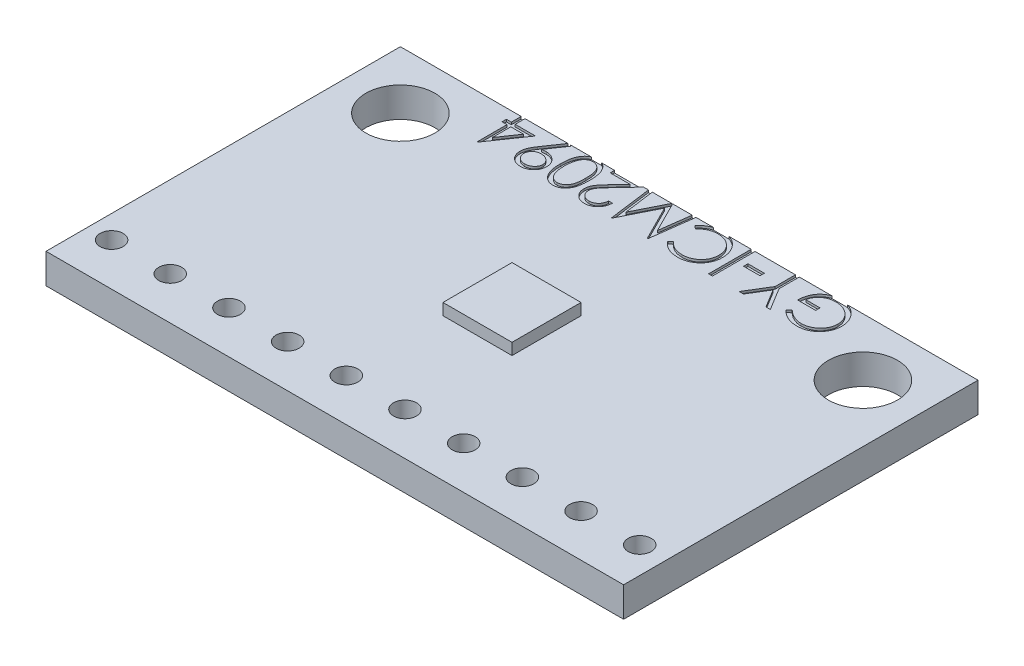
from build123d import *

# Parameters (mm, degrees)
SKETCH2_W           = 25.1
SKETCH2_H           = 15.4
SKETCH2_R           = 1.5
SKETCH2_R_2         = 0.5
BOSS_EXTRUDE1_DEPTH = 1.3
SKETCH3_W           = 3
SKETCH3_H           = 3
BOSS_EXTRUDE2_DEPTH = 0.5
SKETCH4_W           = 0.712339744
SKETCH4_H           = 0.189957265
SKETCH4_W_2         = 0.166212606
SKETCH4_H_2         = 1.852083333
CUT_EXTRUDE1_DEPTH  = 0.1


with BuildPart() as part:
    # Sketch2 → Boss-Extrude1 (new body)
    with BuildSketch(Plane(origin=(0, 0, 0), x_dir=(1, 0, 0), z_dir=(0, 1, 0))):
        Rectangle(SKETCH2_W, SKETCH2_H)
        with Locations(Location((-10.05, 5.2, 0), (0, 0, 270))):
            Circle(SKETCH2_R, mode=Mode.SUBTRACT)
        with Locations(Location((10.05, 5.2, 0), (0, 0, 270))):
            Circle(SKETCH2_R, mode=Mode.SUBTRACT)
        with Locations(Location((-11.55, -5.850560691, 0), (0, 0, 270))):
            Circle(SKETCH2_R_2, mode=Mode.SUBTRACT)
        with Locations(Location((-9, -5.850560691, 0), (0, 0, 270))):
            Circle(SKETCH2_R_2, mode=Mode.SUBTRACT)
        with Locations(Location((-6.45, -5.850560691, 0), (0, 0, 270))):
            Circle(SKETCH2_R_2, mode=Mode.SUBTRACT)
        with Locations(Location((-3.9, -5.850560691, 0), (0, 0, 270))):
            Circle(SKETCH2_R_2, mode=Mode.SUBTRACT)
        with Locations(Location((-1.35, -5.850560691, 0), (0, 0, 270))):
            Circle(SKETCH2_R_2, mode=Mode.SUBTRACT)
        with Locations(Location((1.2, -5.850560691, 0), (0, 0, 270))):
            Circle(SKETCH2_R_2, mode=Mode.SUBTRACT)
        with Locations(Location((3.75, -5.850560691, 0), (0, 0, 270))):
            Circle(SKETCH2_R_2, mode=Mode.SUBTRACT)
        with Locations(Location((6.3, -5.850560691, 0), (0, 0, 270))):
            Circle(SKETCH2_R_2, mode=Mode.SUBTRACT)
        with Locations(Location((8.85, -5.850560691, 0), (0, 0, 270))):
            Circle(SKETCH2_R_2, mode=Mode.SUBTRACT)
        with Locations(Location((11.4, -5.850560691, 0), (0, 0, 270))):
            Circle(SKETCH2_R_2, mode=Mode.SUBTRACT)
    extrude(amount=BOSS_EXTRUDE1_DEPTH)

    # Sketch3 → Boss-Extrude2 (add)
    with BuildSketch(Plane(origin=(0, 1.3, 0), x_dir=(1, 0, 0), z_dir=(0, 1, 0))):
        Rectangle(SKETCH3_W, SKETCH3_H)
    extrude(amount=BOSS_EXTRUDE2_DEPTH)

    # Sketch4 → Cut-Extrude1 (cut)
    # profile 1 of 10: a face of its own
    with BuildSketch(Plane(origin=(0, 1.3, 0), x_dir=(1, 0, 0), z_dir=(0, 1, 0))):
        with BuildLine():
            Line((5.734334936, 6.164017428), (5.876802885, 6.299065171))
            add(Edge.make_bspline(
                [(5.876802885, 6.299065171), (5.902734255, 6.274846309), (5.953840983, 6.227114669), (6.036763977, 6.164492909), (6.123400923, 6.111266201), (6.213047457, 6.067536404), (6.303974858, 6.033543694), (6.394367757, 6.008965172), (6.483592414, 5.993158181), (6.542827681, 5.991301423), (6.572076155, 5.990384615)],
                knots=[0, 0, 0, 0, 1.091957225, 2.152079168, 3.193085318, 4.218301889, 5.218403563, 6.17723952, 7.099979378, 8, 8, 8, 8], degree=3))
            add(Edge.make_bspline(
                [(6.572076155, 5.990384615), (6.590022583, 5.990603805), (6.625868894, 5.991041616), (6.679116172, 5.996616453), (6.73179789, 6.004659252), (6.783732376, 6.016176617), (6.835126115, 6.031135726), (6.885864777, 6.049196619), (6.935850436, 6.070938083), (6.984820129, 6.095725341), (7.03253663, 6.122784711), (7.077414253, 6.152963922), (7.119640144, 6.185334269), (7.1589157, 6.220320282), (7.195778908, 6.25733966), (7.229554971, 6.296918405), (7.26098252, 6.338470714), (7.288886059, 6.38259221), (7.31410674, 6.428029253), (7.335945702, 6.474419652), (7.354750313, 6.521436225), (7.369776345, 6.569105475), (7.381856699, 6.617396963), (7.390407331, 6.666235238), (7.395209989, 6.715860927), (7.396042493, 6.749090919), (7.396461004, 6.765796107)],
                knots=[0, 0, 0, 0, 1.028307134, 2.053947307, 3.065600992, 4.082111276, 5.100671203, 6.132125737, 7.167228006, 8.222953114, 9.277225349, 10.309459149, 11.320441984, 12.324791754, 13.322338422, 14.312705492, 15.305176196, 16.306142747, 17.302479595, 18.282363326, 19.243345101, 20.20291386, 21.145121196, 22.094978082, 23.042318507, 24, 24, 24, 24], degree=3))
            add(Edge.make_bspline(
                [(7.396461004, 6.765796107), (7.39605728, 6.782871708), (7.395250933, 6.816976281), (7.390196113, 6.867894511), (7.380498624, 6.917952712), (7.368653259, 6.967623129), (7.351886468, 7.016271786), (7.332395595, 7.064611124), (7.308893972, 7.112191889), (7.281831328, 7.15868242), (7.251924201, 7.203924919), (7.219036989, 7.246900209), (7.183107579, 7.28710605), (7.144796551, 7.325130268), (7.103754365, 7.360732741), (7.059582961, 7.393484377), (7.01290062, 7.423891606), (6.963686645, 7.451620381), (6.912461205, 7.47638928), (6.859938011, 7.498415424), (6.805948246, 7.516554863), (6.750775918, 7.531338788), (6.694486725, 7.543456859), (6.636794964, 7.551252797), (6.578124822, 7.556910028), (6.538575629, 7.557323662), (6.518650674, 7.557532051)],
                knots=[0, 0, 0, 0, 0.935896426, 1.86923723, 2.799743935, 3.728471844, 4.66505513, 5.616527375, 6.583419551, 7.570341864, 8.562833498, 9.553750335, 10.533080376, 11.5155245, 12.510142773, 13.507781369, 14.526649666, 15.561487327, 16.601173999, 17.643331812, 18.680652164, 19.71969803, 20.772446191, 21.833473655, 22.9085001, 24, 24, 24, 24], degree=3))
            add(Edge.make_bspline(
                [(6.518650674, 7.557532051), (6.494637868, 7.557030305), (6.447484821, 7.556045043), (6.37817255, 7.548369019), (6.311596702, 7.536395848), (6.247974039, 7.518806839), (6.187073559, 7.496543543), (6.129120272, 7.4690116), (6.073952678, 7.436501606), (6.02181505, 7.399668473), (5.973926709, 7.358640205), (5.93039891, 7.314725941), (5.892507166, 7.267575287), (5.860004363, 7.217198505), (5.832028809, 7.164337374), (5.809713076, 7.108085865), (5.792452934, 7.049072276), (5.785392019, 7.008274646), (5.781824252, 6.987660256)],
                knots=[0, 0, 0, 0, 1.130234505, 2.219399076, 3.279128566, 4.311639422, 5.322903917, 6.328167287, 7.327698761, 8.334124803, 9.329374007, 10.292761544, 11.24113083, 12.171311216, 13.111441694, 14.052040787, 15.015727358, 16, 16, 16, 16], degree=3))
            Line((5.781824252, 6.987660256), (6.399185363, 6.987660256))
            Line((6.399185363, 6.987660256), (6.399185363, 6.797702991))
            Line((6.399185363, 6.797702991), (5.615611645, 6.797702991))
            add(Edge.make_bspline(
                [(5.615611645, 6.797702991), (5.616514323, 6.833108204), (5.618281028, 6.902402601), (5.630673537, 7.003457703), (5.650684775, 7.098904391), (5.67802169, 7.188843183), (5.713409859, 7.273146626), (5.756469489, 7.351900313), (5.807889736, 7.424595473), (5.865839011, 7.491825571), (5.930873572, 7.551795613), (6.001236134, 7.604503755), (6.077042946, 7.648902222), (6.158222303, 7.685023489), (6.244508449, 7.713214312), (6.33610105, 7.733201771), (6.432875897, 7.745176793), (6.499199888, 7.746706815), (6.533120075, 7.747489316)],
                knots=[0, 0, 0, 0, 1.140356446, 2.231883559, 3.274166699, 4.278491846, 5.25512956, 6.21435461, 7.1637429, 8.11826594, 9.068280886, 10.0076534, 10.945064095, 11.891975133, 12.864533718, 13.863980011, 14.907571808, 16, 16, 16, 16], degree=3))
            add(Edge.make_bspline(
                [(6.533120075, 7.747489316), (6.554027522, 7.747188156), (6.595263745, 7.746594172), (6.656166028, 7.742372825), (6.715389102, 7.735874354), (6.77292434, 7.726060893), (6.82898338, 7.714041055), (6.883286243, 7.698649333), (6.93603979, 7.680832979), (6.987325558, 7.660568185), (7.036678047, 7.637088184), (7.084317079, 7.610995166), (7.130505987, 7.582423679), (7.174930145, 7.550879607), (7.21782102, 7.516598888), (7.25890205, 7.479512815), (7.298403219, 7.439734764), (7.323147298, 7.411488371), (7.335615318, 7.397255609)],
                knots=[0, 0, 0, 0, 1.107784379, 2.184907829, 3.233506516, 4.263428166, 5.276301166, 6.270063455, 7.25232949, 8.225834625, 9.190232166, 10.146266622, 11.1027726, 12.066435141, 13.031522626, 14.010570082, 14.99756817, 16, 16, 16, 16], degree=3))
            add(Edge.make_bspline(
                [(7.335615318, 7.397255609), (7.353705373, 7.374675722), (7.389585209, 7.32989075), (7.4357699, 7.25813578), (7.475140642, 7.183839795), (7.507085281, 7.106795971), (7.532029185, 7.027076371), (7.549918327, 6.944782863), (7.560399685, 6.859809475), (7.561909681, 6.802307439), (7.562673611, 6.773216313)],
                knots=[0, 0, 0, 0, 1.023165419, 2.029347347, 3.013907458, 3.994755782, 4.975994455, 5.96558838, 6.970761222, 8, 8, 8, 8], degree=3))
            add(Edge.make_bspline(
                [(7.562673611, 6.773216313), (7.562391205, 6.751432733), (7.561829983, 6.70814243), (7.555054373, 6.643867902), (7.545274963, 6.580750555), (7.531109863, 6.518731949), (7.512472141, 6.458087418), (7.490088955, 6.398350974), (7.463871877, 6.339761379), (7.433277509, 6.282837929), (7.399975893, 6.227600091), (7.362528752, 6.175786487), (7.323016339, 6.126395257), (7.279545662, 6.080824762), (7.233745666, 6.037619209), (7.184477141, 5.997917362), (7.132548411, 5.96104938), (7.07754017, 5.927736706), (7.020324955, 5.897802722), (6.961025909, 5.871562407), (6.899664911, 5.849875229), (6.836700658, 5.831474151), (6.771656827, 5.817866543), (6.705005352, 5.807998252), (6.636398835, 5.801245767), (6.590024769, 5.800702707), (6.566511001, 5.80042735)],
                knots=[0, 0, 0, 0, 1.009025537, 2.005226976, 2.991671811, 3.967589759, 4.950148279, 5.929425679, 6.922109907, 7.921964004, 8.922507644, 9.908469609, 10.882248289, 11.851158214, 12.824245259, 13.798023939, 14.780666017, 15.773333703, 16.775582742, 17.771174102, 18.775387309, 19.789283316, 20.80873549, 21.851817535, 22.910773411, 24, 24, 24, 24], degree=3))
            add(Edge.make_bspline(
                [(6.566511001, 5.80042735), (6.54733479, 5.800733232), (6.509310617, 5.801339758), (6.452731137, 5.8055656), (6.397137584, 5.812189289), (6.342251081, 5.821451408), (6.288280611, 5.833703689), (6.235062662, 5.848635675), (6.182697886, 5.865924029), (6.131248581, 5.886558601), (6.080364947, 5.909975333), (6.029765105, 5.936335159), (5.979621657, 5.966087496), (5.929847725, 5.99932105), (5.880129416, 6.035464938), (5.831253126, 6.075552925), (5.782039068, 6.118004133), (5.750393941, 6.148527622), (5.734334936, 6.164017428)],
                knots=[0, 0, 0, 0, 0.985875312, 1.954874891, 2.915472732, 3.863573565, 4.815313299, 5.759461513, 6.704487138, 7.649063459, 8.607849844, 9.583336382, 10.581114205, 11.603942397, 12.659508253, 13.739925933, 14.853076422, 16, 16, 16, 16], degree=3))
        make_face()
    # profile 2 of 10: a face of its own
    with BuildSketch(Plane(origin=(0, 1.3, 0), x_dir=(1, 0, 0), z_dir=(0, 1, 0))):
        Polygon((5.378165064, 5.847916667), (5.187836789, 5.847916667), (4.701813318, 6.642991703), (4.215418837, 5.847916667), (4.024719551, 5.847916667), (4.618336004, 6.819592598), (4.618336004, 7.7), (4.784548611, 7.7), (4.784548611, 6.819592598), align=None)
    # profile 3 of 10: a face of its own
    with BuildSketch(Plane(origin=(0, 1.3, 0), x_dir=(1, 0, 0), z_dir=(0, 1, 0))):
        with Locations((3.526081731, 6.987660256)):
            Rectangle(SKETCH4_W, SKETCH4_H)
    # profile 4 of 10: a face of its own
    with BuildSketch(Plane(origin=(0, 1.3, 0), x_dir=(1, 0, 0), z_dir=(0, 1, 0))):
        with Locations((2.778125, 6.773958334)):
            Rectangle(SKETCH4_W_2, SKETCH4_H_2)
    # profile 5 of 10: a face of its own
    with BuildSketch(Plane(origin=(0, 1.3, 0), x_dir=(1, 0, 0), z_dir=(0, 1, 0))):
        with BuildLine():
            Line((0.581744124, 6.187762086), (0.727180155, 6.299065171))
            add(Edge.make_bspline(
                [(0.727180155, 6.299065171), (0.737555044, 6.286700842), (0.758164946, 6.262138883), (0.791320544, 6.227645637), (0.825881844, 6.195340926), (0.861800758, 6.165017188), (0.899908532, 6.137893197), (0.938753154, 6.111856513), (0.97974602, 6.089060501), (1.036143473, 6.06121232), (1.110208633, 6.032786364), (1.203122279, 6.008337588), (1.300248608, 5.992920752), (1.366496472, 5.991239678), (1.400192808, 5.990384615)],
                knots=[0, 0, 0, 0, 0.75789156, 1.505565099, 2.245254514, 2.979266606, 3.711207489, 4.440978832, 5.174393176, 5.91211879, 7.394186119, 8.890401545, 10.418332761, 12, 12, 12, 12], degree=3))
            add(Edge.make_bspline(
                [(1.400192808, 5.990384615), (1.418757495, 5.990599343), (1.455714571, 5.991026807), (1.510565219, 5.996626567), (1.564495522, 6.00458774), (1.617304932, 6.016113191), (1.668888595, 6.031118282), (1.719639275, 6.048715251), (1.768959276, 6.070612884), (1.817442102, 6.094795927), (1.86388991, 6.122118206), (1.90784628, 6.151910751), (1.949112966, 6.183879249), (1.987794914, 6.217948153), (2.023502347, 6.254515194), (2.056614598, 6.293169521), (2.087089404, 6.334085697), (2.114895323, 6.377068224), (2.139765963, 6.421904781), (2.161332849, 6.468402775), (2.179563198, 6.516384572), (2.194352808, 6.56574734), (2.205927762, 6.616316348), (2.213940094, 6.668272661), (2.219488264, 6.72152546), (2.219911961, 6.757619444), (2.220125534, 6.775813385)],
                knots=[0, 0, 0, 0, 1.054960097, 2.100129169, 3.131228542, 4.15308236, 5.169990287, 6.183953224, 7.204064171, 8.235355279, 9.262684623, 10.264978336, 11.252191258, 12.228402777, 13.192898315, 14.155264692, 15.119862721, 16.091023151, 17.063429752, 18.032246104, 19.00241354, 19.978852882, 20.959535218, 21.948948728, 22.966123959, 24, 24, 24, 24], degree=3))
            add(Edge.make_bspline(
                [(2.220125534, 6.775813385), (2.219456256, 6.803187265), (2.218142217, 6.856932247), (2.206497199, 6.935665358), (2.188659313, 7.011164137), (2.162362883, 7.082917389), (2.12929095, 7.151523264), (2.088026297, 7.216149777), (2.040053716, 7.277743723), (1.984881072, 7.334813333), (1.924339727, 7.386942776), (1.859386048, 7.432848487), (1.79017925, 7.471115061), (1.717484147, 7.50295818), (1.640741153, 7.527435695), (1.560088323, 7.544667544), (1.475701058, 7.555908198), (1.418038084, 7.556984358), (1.38869149, 7.557532051)],
                knots=[0, 0, 0, 0, 1.029159485, 2.020618137, 2.987588728, 3.942669054, 4.889339625, 5.846988364, 6.821327795, 7.821533711, 8.827683044, 9.822769455, 10.807800696, 11.797391277, 12.803701919, 13.832062008, 14.896664671, 16, 16, 16, 16], degree=3))
            add(Edge.make_bspline(
                [(1.38869149, 7.557532051), (1.356357983, 7.556638405), (1.292717908, 7.554879496), (1.199389828, 7.53997856), (1.110047568, 7.515817912), (1.024686325, 7.482005262), (0.943546741, 7.43804988), (0.866501842, 7.38476392), (0.793486594, 7.321640511), (0.749580957, 7.273442355), (0.727180155, 7.248851496)],
                knots=[0, 0, 0, 0, 1.028121516, 2.023589091, 2.998037872, 3.967518031, 4.937445131, 5.927275754, 6.942489185, 8, 8, 8, 8], degree=3))
            Line((0.727180155, 7.248851496), (0.581744124, 7.35904155))
            add(Edge.make_bspline(
                [(0.581744124, 7.35904155), (0.593448685, 7.37414265), (0.616801744, 7.404272518), (0.654609088, 7.446757), (0.694465202, 7.486683692), (0.736477681, 7.523844657), (0.780701368, 7.55842564), (0.827116936, 7.590265845), (0.875492878, 7.619718477), (0.92588977, 7.646413827), (0.978310371, 7.67016823), (1.032305446, 7.690929524), (1.087973905, 7.708362633), (1.144876758, 7.723010054), (1.203598679, 7.733471111), (1.263467787, 7.741796511), (1.325041502, 7.746736855), (1.366545803, 7.747236246), (1.387578459, 7.747489316)],
                knots=[0, 0, 0, 0, 0.986880684, 1.969034265, 2.935876267, 3.899990983, 4.864973347, 5.834408638, 6.8063673, 7.789580233, 8.778939794, 9.778051223, 10.776304221, 11.791326552, 12.811423977, 13.855999788, 14.91350973, 16, 16, 16, 16], degree=3))
            add(Edge.make_bspline(
                [(1.387578459, 7.747489316), (1.407498233, 7.747350679), (1.446887119, 7.74707654), (1.505041875, 7.742635684), (1.561657195, 7.736576865), (1.616571267, 7.727453963), (1.670083763, 7.716688416), (1.721709572, 7.702257376), (1.771956704, 7.686091775), (1.820623284, 7.667092053), (1.867750709, 7.64565224), (1.913186976, 7.621420873), (1.956911188, 7.59460172), (1.999353223, 7.565785944), (2.039886111, 7.534047955), (2.078861102, 7.499828527), (2.116496745, 7.463242997), (2.139781499, 7.43686147), (2.151488632, 7.423597339)],
                knots=[0, 0, 0, 0, 1.114604814, 2.203992996, 3.262667896, 4.300477797, 5.318619304, 6.316056647, 7.298880507, 8.271930387, 9.238335007, 10.195173496, 11.151986948, 12.108099108, 13.064862484, 14.031167946, 15.010108607, 16, 16, 16, 16], degree=3))
            add(Edge.make_bspline(
                [(2.151488632, 7.423597339), (2.17023877, 7.400556318), (2.207512679, 7.354752447), (2.255222194, 7.28052478), (2.295925119, 7.203093818), (2.329202303, 7.122011066), (2.354763062, 7.037245003), (2.372733938, 6.948931995), (2.384330517, 6.857248582), (2.385661563, 6.794894161), (2.386338141, 6.763199035)],
                knots=[0, 0, 0, 0, 0.994611881, 1.977215934, 2.950189954, 3.921972279, 4.908960509, 5.911694611, 6.938501887, 8, 8, 8, 8], degree=3))
            add(Edge.make_bspline(
                [(2.386338141, 6.763199035), (2.385511504, 6.729886501), (2.383885146, 6.664346171), (2.370181573, 6.568137561), (2.34786951, 6.476095545), (2.317145649, 6.387865968), (2.276612663, 6.303953646), (2.227544205, 6.224004181), (2.169460995, 6.148082855), (2.103092503, 6.077160328), (2.030292619, 6.012318315), (1.952337416, 5.955270414), (1.869373371, 5.907795014), (1.782316079, 5.868109513), (1.69051322, 5.837605993), (1.594160776, 5.816252429), (1.493439765, 5.802961289), (1.424720899, 5.801281075), (1.389804521, 5.80042735)],
                knots=[0, 0, 0, 0, 1.032901378, 2.032168977, 3.007206631, 3.966850309, 4.924221947, 5.891988639, 6.871730993, 7.884084801, 8.900290346, 9.89161143, 10.874607481, 11.860025555, 12.854717796, 13.869097222, 14.917278314, 16, 16, 16, 16], degree=3))
            add(Edge.make_bspline(
                [(1.389804521, 5.80042735), (1.368524391, 5.800682513), (1.326402517, 5.801187582), (1.26409133, 5.806111628), (1.203427932, 5.814322581), (1.144243564, 5.825512746), (1.086440606, 5.839431161), (1.030278829, 5.856858854), (0.975919152, 5.877930087), (0.922995026, 5.901381848), (0.872185027, 5.928240446), (0.823514431, 5.957434533), (0.777378431, 5.989526291), (0.733477123, 6.024047671), (0.692013476, 6.061264241), (0.652365205, 6.100550439), (0.615709554, 6.142948409), (0.593086659, 6.172796849), (0.581744124, 6.187762086)],
                knots=[0, 0, 0, 0, 1.096566765, 2.170543479, 3.218870886, 4.250164525, 5.273529809, 6.281496242, 7.278154839, 8.276706968, 9.263143576, 10.238168486, 11.199979644, 12.157579042, 13.114563119, 14.070017788, 15.032356758, 16, 16, 16, 16], degree=3))
        make_face()
    # profile 6 of 10: a face of its own
    with BuildSketch(Plane(origin=(0, 1.3, 0), x_dir=(1, 0, 0), z_dir=(0, 1, 0))):
        Polygon((0.296808226, 7.7), (0.05231245, 5.847916667), (0.028567792, 5.847916667), (-0.736084402, 7.367574786), (-1.498510534, 5.847916667), (-1.522255192, 5.847916667), (-1.76897703, 7.7), (-1.602764423, 7.7), (-1.424679487, 6.368444094), (-0.756489967, 7.7), (-0.718646918, 7.7), (-0.047489316, 6.364362981), (0.129482589, 7.7), align=None)
    # profile 7 of 10: a face of its own
    with BuildSketch(Plane(origin=(0, 1.3, 0), x_dir=(1, 0, 0), z_dir=(0, 1, 0))):
        with BuildLine():
            Line((-2.220125534, 6.417788462), (-2.053912927, 6.417788462))
            add(Edge.make_bspline(
                [(-2.053912927, 6.417788462), (-2.054996028, 6.395737508), (-2.057123209, 6.352430022), (-2.067089121, 6.289289327), (-2.081335893, 6.228929762), (-2.101526891, 6.171868802), (-2.12646101, 6.117424805), (-2.156987587, 6.066320723), (-2.192455845, 6.018049356), (-2.232800717, 5.97352464), (-2.27657862, 5.932823483), (-2.323527259, 5.897304009), (-2.373164089, 5.867636888), (-2.425058581, 5.842700988), (-2.479810912, 5.824006294), (-2.53689771, 5.810129046), (-2.596577001, 5.801781174), (-2.637238133, 5.80088376), (-2.657917668, 5.80042735)],
                knots=[0, 0, 0, 0, 1.100776268, 2.161895295, 3.184016182, 4.190939212, 5.176500551, 6.166955529, 7.155448256, 8.160289653, 9.16017456, 10.133824356, 11.091467644, 12.04088621, 13.000931625, 13.972173743, 14.968683325, 16, 16, 16, 16], degree=3))
            add(Edge.make_bspline(
                [(-2.657917668, 5.80042735), (-2.678227495, 5.800898925), (-2.718135579, 5.801825554), (-2.77635651, 5.809902845), (-2.831913242, 5.822280574), (-2.88417615, 5.840622418), (-2.933681599, 5.86363742), (-2.979816628, 5.892259591), (-3.023696832, 5.925134625), (-3.063168646, 5.96391234), (-3.09942827, 6.00528826), (-3.130681872, 6.049477395), (-3.157597721, 6.09517032), (-3.179627502, 6.142723966), (-3.196327056, 6.192293188), (-3.208699825, 6.243402751), (-3.215772769, 6.296642492), (-3.216852323, 6.332683248), (-3.217401175, 6.351006611)],
                knots=[0, 0, 0, 0, 1.111674182, 2.184400057, 3.212814286, 4.223731311, 5.211378316, 6.196328225, 7.191884489, 8.207283132, 9.220262353, 10.201199469, 11.166417575, 12.120932471, 13.06540007, 14.026332106, 14.996573967, 16, 16, 16, 16], degree=3))
            add(Edge.make_bspline(
                [(-3.217401175, 6.351006611), (-3.216503624, 6.376801737), (-3.214724271, 6.427939322), (-3.199552054, 6.503097689), (-3.175751961, 6.575822825), (-3.147439727, 6.634580351), (-3.118986051, 6.681977091), (-3.092672766, 6.720636818), (-3.062282627, 6.762490411), (-3.027368071, 6.807492845), (-2.987401719, 6.855069631), (-2.943908157, 6.90649898), (-2.894968295, 6.960155398), (-2.860771646, 6.996845267), (-2.8430518, 7.015857038)],
                knots=[0, 0, 0, 0, 1.184219417, 2.34765746, 3.508456027, 4.692825395, 5.335023057, 6.047372803, 6.840716919, 7.711366838, 8.663720231, 9.695456184, 10.805843131, 12, 12, 12, 12], degree=3))
            Line((-2.8430518, 7.015857038), (-2.379659956, 7.510042735))
            Line((-2.379659956, 7.510042735), (-3.241145833, 7.510042735))
            Line((-3.241145833, 7.510042735), (-3.241145833, 7.7))
            Line((-3.241145833, 7.7), (-1.982678953, 7.7))
            Line((-1.982678953, 7.7), (-2.700954861, 6.933492755))
            add(Edge.make_bspline(
                [(-2.700954861, 6.933492755), (-2.718443939, 6.915238397), (-2.752036879, 6.880175511), (-2.799530537, 6.828969261), (-2.842256094, 6.781520296), (-2.880241891, 6.737618357), (-2.913519185, 6.697512328), (-2.941981501, 6.660887907), (-2.96575464, 6.628059394), (-2.990949212, 6.589493829), (-3.014973909, 6.542351677), (-3.036089159, 6.485031289), (-3.048872044, 6.425893954), (-3.050413302, 6.385942797), (-3.051188568, 6.365847022)],
                knots=[0, 0, 0, 0, 1.329530082, 2.553755191, 3.672934919, 4.687409497, 5.60679272, 6.413407421, 7.126401618, 7.737995624, 8.834647426, 9.90044882, 10.943907757, 12, 12, 12, 12], degree=3))
            add(Edge.make_bspline(
                [(-3.051188568, 6.365847022), (-3.05085561, 6.353208385), (-3.050199414, 6.32830006), (-3.044298467, 6.291804549), (-3.035628805, 6.256463873), (-3.022266177, 6.222714992), (-3.006211471, 6.189894132), (-2.985700401, 6.15899915), (-2.962261634, 6.128976909), (-2.935073814, 6.100856848), (-2.90522664, 6.075094505), (-2.873690325, 6.052275165), (-2.840326579, 6.033204342), (-2.805274443, 6.017570942), (-2.768632068, 6.005307293), (-2.730328468, 5.996809631), (-2.690469511, 5.991474316), (-2.66325262, 5.990752442), (-2.649384432, 5.990384615)],
                knots=[0, 0, 0, 0, 0.991504627, 1.954065223, 2.895985987, 3.842598665, 4.797835564, 5.759220273, 6.74786863, 7.784730864, 8.824135544, 9.839918996, 10.835834653, 11.835434876, 12.84861661, 13.863796685, 14.911511676, 16, 16, 16, 16], degree=3))
            add(Edge.make_bspline(
                [(-2.649384432, 5.990384615), (-2.634897, 5.990747942), (-2.606446075, 5.991461455), (-2.564763583, 5.996869296), (-2.52472153, 6.005059195), (-2.486936955, 6.018097447), (-2.450619092, 6.033357017), (-2.416694429, 6.053115477), (-2.384209979, 6.075692573), (-2.353818853, 6.102016033), (-2.326139104, 6.131731254), (-2.300958589, 6.164075747), (-2.279622889, 6.199622915), (-2.260683403, 6.237519792), (-2.246198436, 6.278807563), (-2.233814826, 6.322476484), (-2.224819552, 6.369149609), (-2.221716195, 6.40130623), (-2.220125534, 6.417788462)],
                knots=[0, 0, 0, 0, 1.031072318, 2.024855787, 2.988461151, 3.935103592, 4.865765533, 5.788564469, 6.724086513, 7.67908574, 8.64457978, 9.611397706, 10.591395687, 11.591555111, 12.622101007, 13.700900657, 14.821571223, 16, 16, 16, 16], degree=3))
        make_face()
    # profile 8 of 10: a face of its own
    with BuildSketch(Plane(origin=(0, 1.3, 0), x_dir=(1, 0, 0), z_dir=(0, 1, 0))):
        with BuildLine():
            add(Edge.make_bspline(
                [(-3.40735844, 6.774700354), (-3.407532016, 6.745015486), (-3.407869191, 6.687352203), (-3.411620147, 6.603328663), (-3.417851265, 6.524503843), (-3.426390627, 6.450873972), (-3.436782386, 6.382420033), (-3.450654766, 6.319324992), (-3.466430643, 6.261296723), (-3.484714863, 6.208146345), (-3.505345153, 6.159156601), (-3.527802587, 6.113425765), (-3.55296294, 6.071008464), (-3.579442486, 6.031279731), (-3.608167959, 5.994639384), (-3.639039468, 5.961252091), (-3.671785093, 5.930600468), (-3.706559777, 5.903188539), (-3.743032075, 5.8793027), (-3.780123088, 5.857650727), (-3.818890727, 5.84052342), (-3.858378768, 5.825877599), (-3.898905357, 5.814276129), (-3.940488149, 5.806206397), (-3.983164458, 5.801157801), (-4.011967269, 5.800673144), (-4.026574603, 5.80042735)],
                knots=[0, 0, 0, 0, 1.64625301, 3.197870201, 4.6634513, 6.030635694, 7.308242971, 8.501545196, 9.611429483, 10.641742253, 11.616230371, 12.55791849, 13.464870342, 14.34944951, 15.20427819, 16.044004467, 16.869007726, 17.689551165, 18.496129964, 19.285613293, 20.0683943, 20.843080271, 21.620342827, 22.403213977, 23.190190624, 24, 24, 24, 24], degree=3))
            add(Edge.make_bspline(
                [(-4.026574603, 5.80042735), (-4.041311353, 5.800631741), (-4.070632301, 5.801038406), (-4.113825608, 5.806762465), (-4.156266562, 5.814150673), (-4.197311249, 5.826000143), (-4.237735746, 5.840179569), (-4.276534775, 5.858889098), (-4.315078149, 5.879237163), (-4.351614893, 5.90406009), (-4.387236658, 5.93149351), (-4.420628344, 5.962637455), (-4.452643531, 5.996630013), (-4.482073018, 6.034229318), (-4.510178112, 6.07485886), (-4.535891916, 6.118859232), (-4.559749229, 6.166132924), (-4.582198505, 6.216460781), (-4.601829805, 6.271187139), (-4.6192836, 6.329970654), (-4.633589937, 6.393343641), (-4.645421027, 6.46095307), (-4.654604205, 6.533133879), (-4.661287567, 6.609739821), (-4.664819143, 6.690818821), (-4.665484091, 6.746253201), (-4.665825321, 6.774700354)],
                knots=[0, 0, 0, 0, 0.810910589, 1.61342667, 2.396193133, 3.181089899, 3.963115317, 4.752255436, 5.550715454, 6.36105385, 7.181178335, 8.024612154, 8.872680183, 9.750181803, 10.651284446, 11.591556747, 12.554036451, 13.566402641, 14.62422919, 15.753422176, 16.94128843, 18.199818041, 19.531985927, 20.947085226, 22.433341622, 24, 24, 24, 24], degree=3))
            add(Edge.make_bspline(
                [(-4.665825321, 6.774700354), (-4.665476158, 6.803023068), (-4.664794307, 6.858332253), (-4.661367941, 6.9390517), (-4.654425046, 7.015239622), (-4.645962914, 7.087006403), (-4.633762174, 7.15425823), (-4.620179105, 7.217356271), (-4.602853138, 7.275707645), (-4.583687488, 7.329964901), (-4.561550578, 7.380079565), (-4.537872939, 7.427158127), (-4.511775287, 7.470908787), (-4.484209478, 7.51179586), (-4.454222832, 7.549072703), (-4.422640906, 7.583445509), (-4.388925269, 7.614643563), (-4.353120132, 7.642400898), (-4.31623805, 7.667410814), (-4.277687162, 7.688484429), (-4.23836991, 7.706856321), (-4.197877342, 7.721625174), (-4.156467667, 7.73330001), (-4.113991764, 7.741247595), (-4.070626524, 7.746849641), (-4.041309421, 7.747275353), (-4.026574603, 7.747489316)],
                knots=[0, 0, 0, 0, 1.561431216, 3.049195289, 4.452146966, 5.778046447, 7.031138842, 8.218704273, 9.334037798, 10.384210803, 11.388620812, 12.352076869, 13.287433199, 14.19507451, 15.06813243, 15.922055533, 16.766344942, 17.596869952, 18.417486629, 19.220035357, 20.016159057, 20.807716045, 21.59340902, 22.384936649, 23.188266813, 24, 24, 24, 24], degree=3))
            add(Edge.make_bspline(
                [(-4.026574603, 7.747489316), (-4.011967778, 7.747241344), (-3.983165971, 7.746752392), (-3.940482308, 7.741735261), (-3.89895981, 7.733554009), (-3.858515465, 7.72244391), (-3.819066516, 7.708323629), (-3.780999364, 7.690363175), (-3.743811418, 7.669531764), (-3.70767182, 7.645832436), (-3.673271453, 7.618672471), (-3.640405249, 7.588638713), (-3.60993346, 7.554957156), (-3.581406088, 7.518165386), (-3.554706833, 7.478336643), (-3.529653028, 7.435594614), (-3.507263985, 7.389418281), (-3.486165927, 7.340162594), (-3.467567828, 7.286621681), (-3.451328311, 7.228394557), (-3.437636921, 7.165084059), (-3.426731537, 7.096687156), (-3.417797596, 7.023309733), (-3.41162629, 6.944834857), (-3.407871066, 6.861430615), (-3.407532434, 6.804138001), (-3.40735844, 6.774700354)],
                knots=[0, 0, 0, 0, 0.810976328, 1.599087026, 2.383086309, 3.159618043, 3.926613167, 4.707144544, 5.494386734, 6.292609454, 7.104690378, 7.92621526, 8.762510248, 9.62398222, 10.509836085, 11.424023232, 12.373226806, 13.358118208, 14.398657954, 15.5185989, 16.713620699, 17.994156382, 19.364120462, 20.818119981, 22.365111093, 24, 24, 24, 24], degree=3))
        make_face()
        with BuildLine():
            add(Edge.make_bspline(
                [(-3.573571047, 6.773958333), (-3.57363564, 6.798696088), (-3.573761003, 6.846707211), (-3.576941246, 6.91635233), (-3.581367819, 6.981419475), (-3.586936705, 7.041883248), (-3.595276896, 7.097532339), (-3.604739375, 7.148598074), (-3.616088967, 7.194986016), (-3.62958403, 7.237101266), (-3.644955408, 7.275541112), (-3.661711572, 7.311326937), (-3.679862121, 7.344894023), (-3.69982348, 7.37612126), (-3.721881638, 7.404834235), (-3.745544251, 7.431169317), (-3.770948909, 7.455019276), (-3.806108905, 7.483324345), (-3.852300848, 7.512918314), (-3.910798325, 7.538371939), (-3.970933614, 7.554471311), (-4.011761362, 7.556512987), (-4.032139757, 7.557532051)],
                knots=[0, 0, 0, 0, 1.459193451, 2.832007961, 4.111736495, 5.306635028, 6.412683014, 7.430020708, 8.369596877, 9.227877302, 10.036669781, 10.810175692, 11.557788084, 12.286326232, 12.994037279, 13.69140682, 14.37267704, 15.047194847, 16.352618509, 17.594157723, 18.799169539, 20, 20, 20, 20], degree=3))
            add(Edge.make_bspline(
                [(-4.032139757, 7.557532051), (-4.052635168, 7.556638472), (-4.093553288, 7.554854483), (-4.153647645, 7.53928453), (-4.21150487, 7.51397273), (-4.257165177, 7.485054599), (-4.291806332, 7.4573386), (-4.316635305, 7.43373529), (-4.339421732, 7.407298844), (-4.361034156, 7.37877754), (-4.380856206, 7.347624071), (-4.398881295, 7.313988907), (-4.415329563, 7.277778458), (-4.424700601, 7.252500306), (-4.42949177, 7.239576239)],
                knots=[0, 0, 0, 0, 1.353621445, 2.702441307, 4.075953605, 5.516772412, 6.261413105, 7.007624062, 7.778524365, 8.566925914, 9.372323995, 10.217594641, 11.088702136, 12, 12, 12, 12], degree=3))
            add(Edge.make_bspline(
                [(-4.42949177, 7.239576239), (-4.435075414, 7.223050502), (-4.446412605, 7.189496168), (-4.461023836, 7.137445402), (-4.472530776, 7.082833939), (-4.482883057, 7.025988149), (-4.48994905, 6.966488807), (-4.495636434, 6.904520012), (-4.498986423, 6.840035041), (-4.499401687, 6.796222692), (-4.499612714, 6.773958333)],
                knots=[0, 0, 0, 0, 0.884706709, 1.796334032, 2.740027952, 3.714592787, 4.726048262, 5.777819803, 6.87074269, 8, 8, 8, 8], degree=3))
            add(Edge.make_bspline(
                [(-4.499612714, 6.773958333), (-4.499379973, 6.751694454), (-4.498924628, 6.708136158), (-4.495932964, 6.644410332), (-4.491125608, 6.583778764), (-4.484618958, 6.52618645), (-4.475686705, 6.471735897), (-4.464959952, 6.420349193), (-4.452384085, 6.372040167), (-4.437959123, 6.326684322), (-4.421702623, 6.284444377), (-4.403743265, 6.245229406), (-4.384580962, 6.208827903), (-4.363754222, 6.175356951), (-4.341557706, 6.144621246), (-4.317194418, 6.117328305), (-4.292211893, 6.092150401), (-4.256681455, 6.063924116), (-4.210544108, 6.034916948), (-4.152737645, 6.008948946), (-4.09291045, 5.993580382), (-4.052382049, 5.991449103), (-4.032139757, 5.990384615)],
                knots=[0, 0, 0, 0, 1.313528337, 2.569860077, 3.762944266, 4.901481389, 5.988248151, 7.017139294, 7.997571128, 8.932104357, 9.823695246, 10.66607014, 11.475539426, 12.248954257, 12.990316782, 13.708962568, 14.405488541, 15.08007697, 16.381737273, 17.610043218, 18.806313575, 20, 20, 20, 20], degree=3))
            add(Edge.make_bspline(
                [(-4.032139757, 5.990384615), (-4.011651429, 5.991450363), (-3.970637448, 5.993583798), (-3.910184391, 6.008894724), (-3.852031874, 6.034732255), (-3.805991752, 6.063959986), (-3.770961512, 6.092040783), (-3.746033366, 6.116007148), (-3.722507703, 6.142095942), (-3.700555215, 6.170678732), (-3.680715646, 6.201846424), (-3.662344495, 6.235170168), (-3.645722015, 6.270902835), (-3.630292617, 6.309321435), (-3.616940744, 6.351505889), (-3.604935854, 6.397884579), (-3.595669886, 6.449282418), (-3.58744252, 6.505192836), (-3.581223566, 6.565728496), (-3.576972097, 6.630949671), (-3.573751344, 6.700837568), (-3.57363235, 6.749096575), (-3.573571047, 6.773958333)],
                knots=[0, 0, 0, 0, 1.207779899, 2.417760083, 3.652287919, 4.947299644, 5.621638849, 6.297435916, 6.984320042, 7.691843698, 8.42018894, 9.161205785, 9.934506883, 10.743085206, 11.601138371, 12.542248028, 13.566483018, 14.679455109, 15.87477181, 17.154161492, 18.533899613, 20, 20, 20, 20], degree=3))
        make_face(mode=Mode.SUBTRACT)
    # profile 9 of 10: a face of its own
    with BuildSketch(Plane(origin=(0, 1.3, 0), x_dir=(1, 0, 0), z_dir=(0, 1, 0))):
        with BuildLine():
            Line((-5.235697115, 7.747489316), (-5.102875434, 7.655107756))
            Line((-5.102875434, 7.655107756), (-5.617837707, 6.902327891))
            add(Edge.make_bspline(
                [(-5.617837707, 6.902327891), (-5.584985902, 6.906533374), (-5.520316041, 6.914812005), (-5.45512955, 6.915893955), (-5.423057308, 6.916426282)],
                knots=[0, 0, 0, 0, 1.015985029, 2, 2, 2, 2], degree=3))
            add(Edge.make_bspline(
                [(-5.423057308, 6.916426282), (-5.403615179, 6.915926819), (-5.36545198, 6.914946416), (-5.309335914, 6.907219463), (-5.255335182, 6.895183829), (-5.203655461, 6.877641075), (-5.154342835, 6.855220955), (-5.107225049, 6.827910393), (-5.062365166, 6.795607416), (-5.020288479, 6.758660446), (-4.982030155, 6.718080697), (-4.947917704, 6.67514628), (-4.919722189, 6.629391353), (-4.895881969, 6.581781508), (-4.878308937, 6.531300403), (-4.865202941, 6.478804651), (-4.857222505, 6.423968377), (-4.856267484, 6.38664999), (-4.855782585, 6.367702073)],
                knots=[0, 0, 0, 0, 1.060682839, 2.082027659, 3.085691555, 4.076014095, 5.054630121, 6.037449673, 7.043289733, 8.066773124, 9.088474683, 10.083546559, 11.053653938, 12.01652662, 12.983553501, 13.964076119, 14.966286614, 16, 16, 16, 16], degree=3))
            add(Edge.make_bspline(
                [(-4.855782585, 6.367702073), (-4.856702235, 6.341790494), (-4.858507321, 6.290931319), (-4.872979452, 6.216604232), (-4.896957101, 6.146285895), (-4.929865179, 6.080054939), (-4.972108665, 6.01943269), (-5.022275935, 5.964624538), (-5.080772455, 5.916608182), (-5.146070977, 5.875380489), (-5.216543741, 5.841996822), (-5.290656762, 5.818279148), (-5.367161562, 5.803127745), (-5.419153452, 5.801331364), (-5.445317925, 5.80042735)],
                knots=[0, 0, 0, 0, 1.023011052, 2.007963168, 2.978169221, 3.950402619, 4.919353283, 5.887490769, 6.876420893, 7.899700203, 8.931203047, 9.947778163, 10.96723692, 12, 12, 12, 12], degree=3))
            add(Edge.make_bspline(
                [(-5.445317925, 5.80042735), (-5.470977372, 5.801392337), (-5.521678021, 5.803299059), (-5.596333292, 5.817385799), (-5.667899725, 5.840874926), (-5.735817036, 5.873483064), (-5.79836803, 5.914626891), (-5.854861593, 5.963229426), (-5.903574378, 6.019848757), (-5.945119869, 6.0827503), (-5.977844511, 6.150757755), (-6.001824279, 6.221608426), (-6.016482044, 6.294878335), (-6.018335461, 6.344509525), (-6.019270833, 6.369557125)],
                knots=[0, 0, 0, 0, 1.026310256, 2.027892329, 3.027798401, 4.032590076, 5.033095916, 6.015299856, 7.004484051, 8.011843335, 9.023241558, 10.015317641, 10.998381257, 12, 12, 12, 12], degree=3))
            add(Edge.make_bspline(
                [(-6.019270833, 6.369557125), (-6.018652254, 6.389001576), (-6.017397621, 6.428439782), (-6.008484423, 6.488195849), (-5.993820855, 6.549204066), (-5.977075503, 6.60095567), (-5.959670715, 6.643397339), (-5.945133433, 6.677554181), (-5.927407417, 6.712956025), (-5.907234296, 6.749858879), (-5.885607043, 6.788800294), (-5.861227021, 6.82905601), (-5.834608989, 6.870853586), (-5.815648813, 6.89902998), (-5.805939921, 6.9134582)],
                knots=[0, 0, 0, 0, 1.179744101, 2.39281581, 3.657884751, 4.98449437, 5.688244212, 6.441097573, 7.23650985, 8.089392143, 8.993247458, 9.939208743, 10.944735416, 12, 12, 12, 12], degree=3))
            Line((-5.805939921, 6.9134582), (-5.235697115, 7.747489316))
        make_face()
        with BuildLine():
            add(Edge.make_bspline(
                [(-5.453851162, 6.726469017), (-5.468579641, 6.726065814), (-5.497250982, 6.725280914), (-5.539259708, 6.720525085), (-5.578889438, 6.712030558), (-5.616395232, 6.700035099), (-5.651731685, 6.684839247), (-5.684909928, 6.666320615), (-5.71559106, 6.644073497), (-5.74388431, 6.619067292), (-5.769561296, 6.591661484), (-5.791700775, 6.562298706), (-5.810869557, 6.531891158), (-5.82616196, 6.499816353), (-5.838486071, 6.466598998), (-5.847085406, 6.431758706), (-5.851834936, 6.395536028), (-5.852646038, 6.370930773), (-5.853058226, 6.358426816)],
                knots=[0, 0, 0, 0, 1.163726718, 2.265380301, 3.334713825, 4.36057981, 5.371541381, 6.368955992, 7.355979581, 8.359691305, 9.348261197, 10.317521986, 11.261029684, 12.183096459, 13.119698615, 14.055740009, 15.011961376, 16, 16, 16, 16], degree=3))
            add(Edge.make_bspline(
                [(-5.853058226, 6.358426816), (-5.852704235, 6.345917295), (-5.852006653, 6.321265748), (-5.84639881, 6.284994368), (-5.83656305, 6.250221048), (-5.823223525, 6.21671795), (-5.806016817, 6.184634817), (-5.78509098, 6.154064698), (-5.760310745, 6.124895132), (-5.732074835, 6.097491606), (-5.701090887, 6.072310595), (-5.667970032, 6.050457483), (-5.633438426, 6.031673938), (-5.597103675, 6.016968277), (-5.5594589, 6.004896664), (-5.520090061, 5.996356985), (-5.478949375, 5.99159797), (-5.451018602, 5.990794218), (-5.436784689, 5.990384615)],
                knots=[0, 0, 0, 0, 0.97180342, 1.915057841, 2.843062057, 3.774592458, 4.711855407, 5.666109401, 6.64802866, 7.681008178, 8.719604906, 9.745767187, 10.760480799, 11.768803314, 12.78696958, 13.829338598, 14.893800474, 16, 16, 16, 16], degree=3))
            add(Edge.make_bspline(
                [(-5.436784689, 5.990384615), (-5.422674532, 5.990794816), (-5.394990521, 5.991599625), (-5.354216066, 5.996348693), (-5.315111606, 6.004951585), (-5.277583008, 6.016974216), (-5.241324893, 6.031592076), (-5.207068167, 6.050457042), (-5.174292417, 6.072427251), (-5.143317425, 6.09745917), (-5.115143322, 6.125026865), (-5.089933701, 6.153934728), (-5.06905579, 6.184651288), (-5.051824826, 6.2167136), (-5.038491716, 6.250222205), (-5.028654244, 6.284994054), (-5.023046861, 6.321265829), (-5.022349215, 6.345917322), (-5.021995192, 6.358426816)],
                knots=[0, 0, 0, 0, 1.099260809, 2.156740654, 3.192227907, 4.212865946, 5.223636336, 6.232338816, 7.252976855, 8.294094955, 9.329582207, 10.320135147, 11.276705756, 12.216244072, 13.150035923, 14.080293028, 15.025837361, 16, 16, 16, 16], degree=3))
            add(Edge.make_bspline(
                [(-5.021995192, 6.358426816), (-5.022316176, 6.370940473), (-5.022949216, 6.395619694), (-5.029044321, 6.431884197), (-5.039264452, 6.466634431), (-5.052816398, 6.500167037), (-5.071003502, 6.532048191), (-5.093106092, 6.56244321), (-5.118608708, 6.59197348), (-5.148347128, 6.618981602), (-5.180281048, 6.644193182), (-5.214581479, 6.666180735), (-5.250559136, 6.684617973), (-5.287983017, 6.700079893), (-5.327133155, 6.711909558), (-5.367955033, 6.720509307), (-5.410456002, 6.725235319), (-5.43924733, 6.726053839), (-5.453851162, 6.726469017)],
                knots=[0, 0, 0, 0, 0.952872936, 1.879239831, 2.791748947, 3.708674669, 4.628500839, 5.580394867, 6.568761142, 7.595635223, 8.636123962, 9.665976811, 10.694276597, 11.712685318, 12.747011694, 13.805940053, 14.887106426, 16, 16, 16, 16], degree=3))
        make_face(mode=Mode.SUBTRACT)
    # profile 10 of 10: a face of its own
    with BuildSketch(Plane(origin=(0, 1.3, 0), x_dir=(1, 0, 0), z_dir=(0, 1, 0))):
        Polygon((-7.267720436, 5.80042735), (-7.301482372, 5.80042735), (-7.301482372, 7.082638889), (-7.515184295, 7.082638889), (-7.515184295, 7.272596154), (-7.301482372, 7.272596154), (-7.301482372, 7.7), (-7.135269765, 7.7), (-7.135269765, 7.272596154), (-6.256717415, 7.272596154), align=None)
        Polygon((-7.135269765, 7.082638889), (-7.135269765, 6.279030616), (-6.583577474, 7.082638889), align=None, mode=Mode.SUBTRACT)
    extrude(amount=-CUT_EXTRUDE1_DEPTH, mode=Mode.SUBTRACT)


solid = part.part
